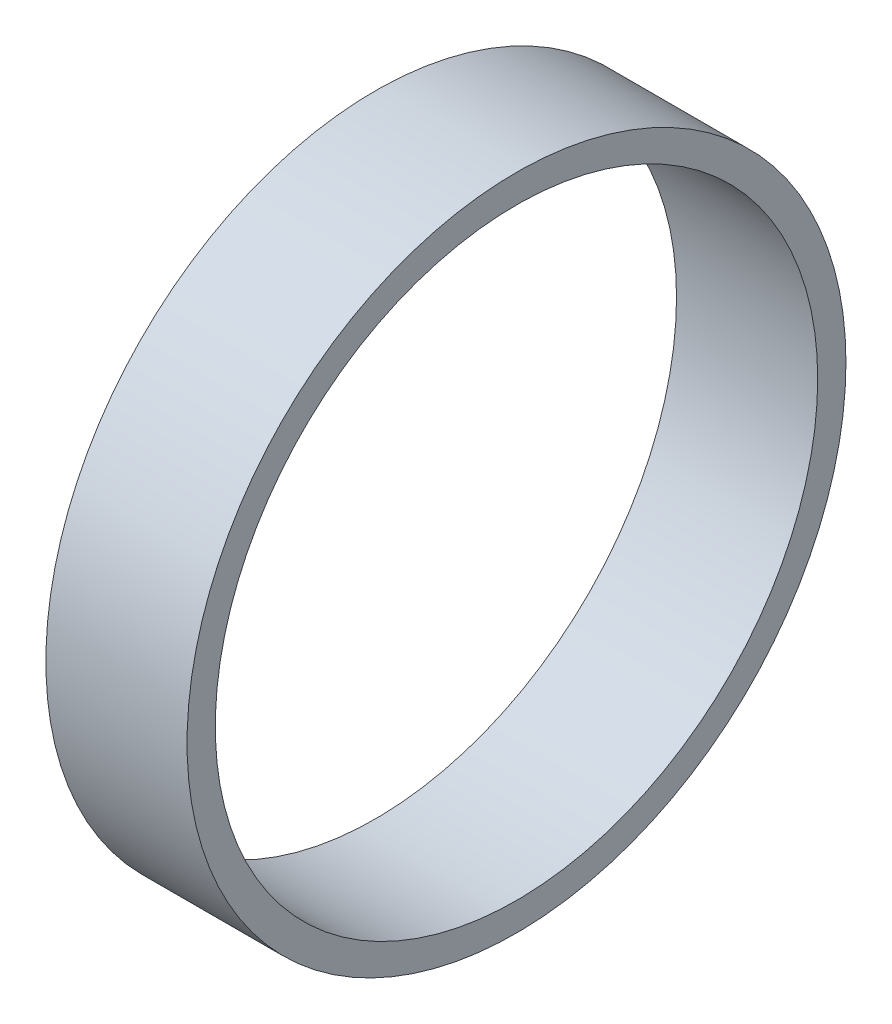
from build123d import *

# Parameters (mm, degrees)
SKETCH1_R           = 35
SKETCH1_R_2         = 32
BOSS_EXTRUDE1_DEPTH = 15


with BuildPart() as part:
    # Sketch1 → Boss-Extrude1 (new body)
    with BuildSketch(Plane(origin=(0, 0, 0), x_dir=(0, 0, -1), z_dir=(1, 0, 0))):
        Circle(SKETCH1_R)
        Circle(SKETCH1_R_2, mode=Mode.SUBTRACT)
    extrude(amount=BOSS_EXTRUDE1_DEPTH)


solid = part.part
